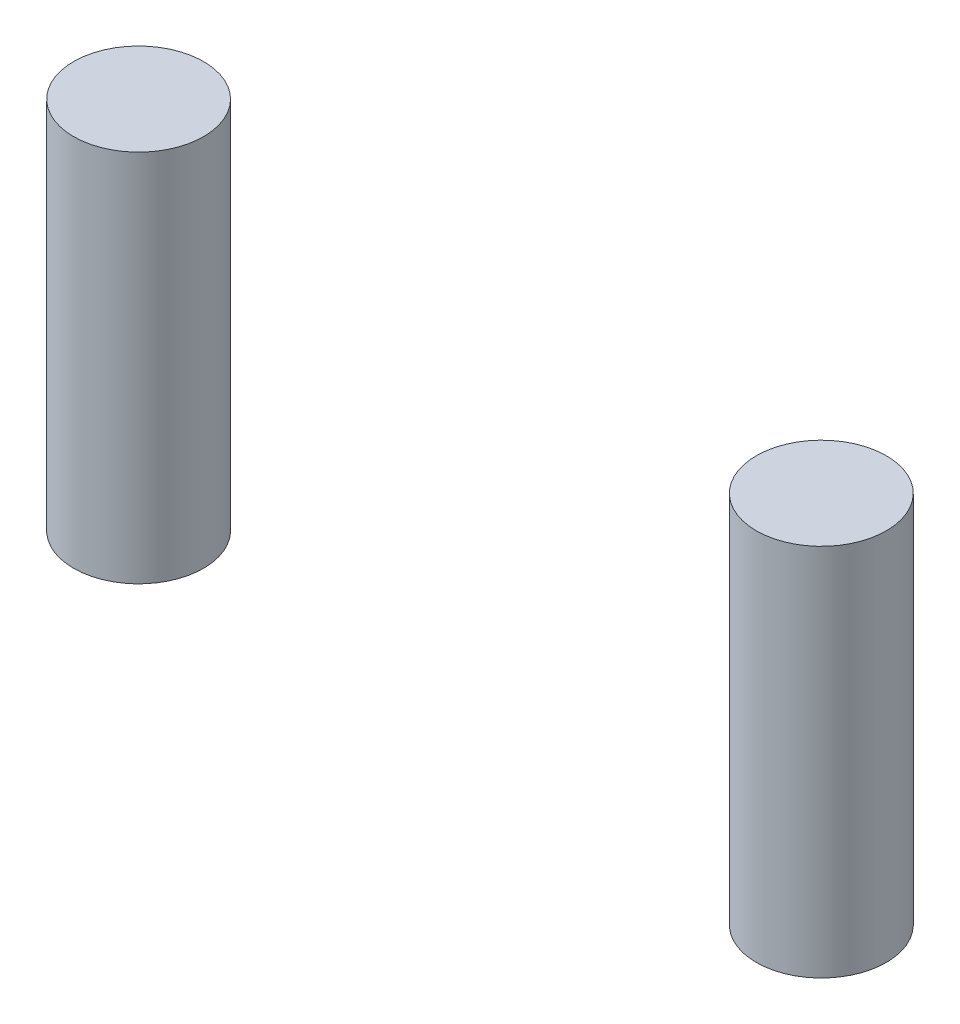
from build123d import *

# Parameters (mm, degrees)
SKETCH1_R           = 2
BOSS_EXTRUDE1_DEPTH = 11.5
SKETCH2_R           = 2
BOSS_EXTRUDE2_DEPTH = 11.5


with BuildPart() as part:
    # Sketch1 → Boss-Extrude1 (new body)
    with BuildSketch(Plane(origin=(0, -108, 0), x_dir=(1, 0, 0), z_dir=(0, 1, 0))):
        with Locations(Location((-10.5, -26, 0), (0, 0, 270))):
            Circle(SKETCH1_R)
    extrude(amount=BOSS_EXTRUDE1_DEPTH)


with BuildPart() as body_2:
    # Sketch2 → Boss-Extrude2 (new body)
    with BuildSketch(Plane(origin=(0, -108, 0), x_dir=(1, 0, 0), z_dir=(0, 1, 0))):
        with Locations(Location((10.5, -26, 0), (0, 0, 270))):
            Circle(SKETCH2_R)
    extrude(amount=BOSS_EXTRUDE2_DEPTH)


solid = Compound([part.part, body_2.part])
